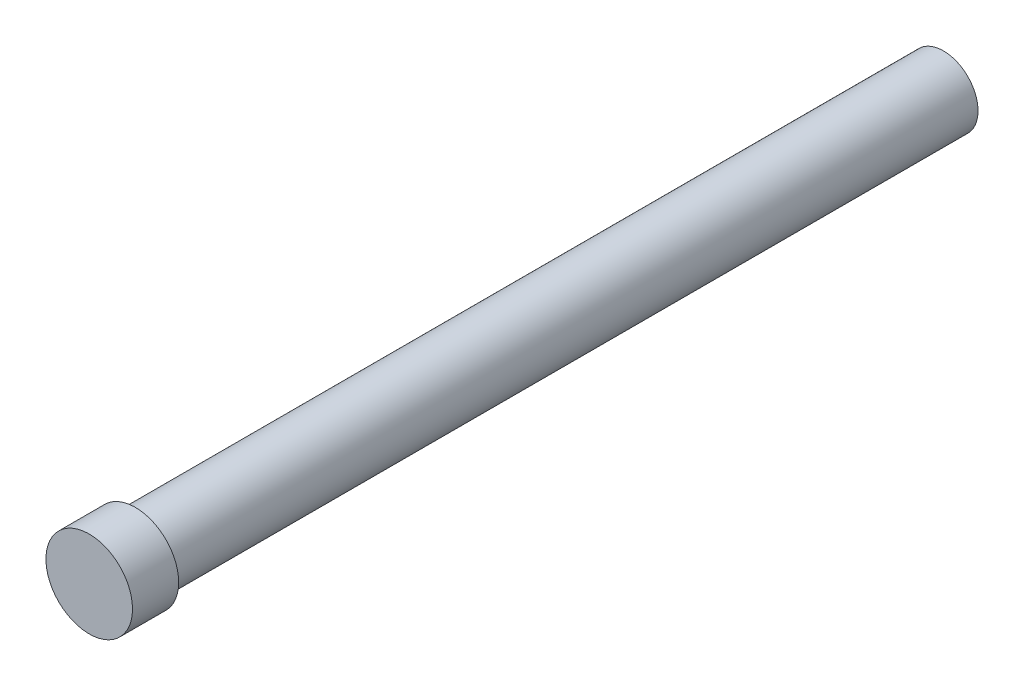
from build123d import *

# Parameters (mm, degrees)
SKETCH1_R           = 7.5
BOSS_EXTRUDE1_DEPTH = 8
SKETCH3_R           = 6
BOSS_EXTRUDE2_DEPTH = 140


with BuildPart() as part:
    # Sketch1 → Boss-Extrude1 (new body)
    with BuildSketch(Plane.XY):
        Circle(SKETCH1_R)
    extrude(amount=BOSS_EXTRUDE1_DEPTH)

    # Sketch3 → Boss-Extrude2 (add)
    with BuildSketch(Plane(origin=(0, 0, 0), x_dir=(-1, 0, 0), z_dir=(0, 0, -1))):
        Circle(SKETCH3_R)
    extrude(amount=BOSS_EXTRUDE2_DEPTH)


solid = part.part
